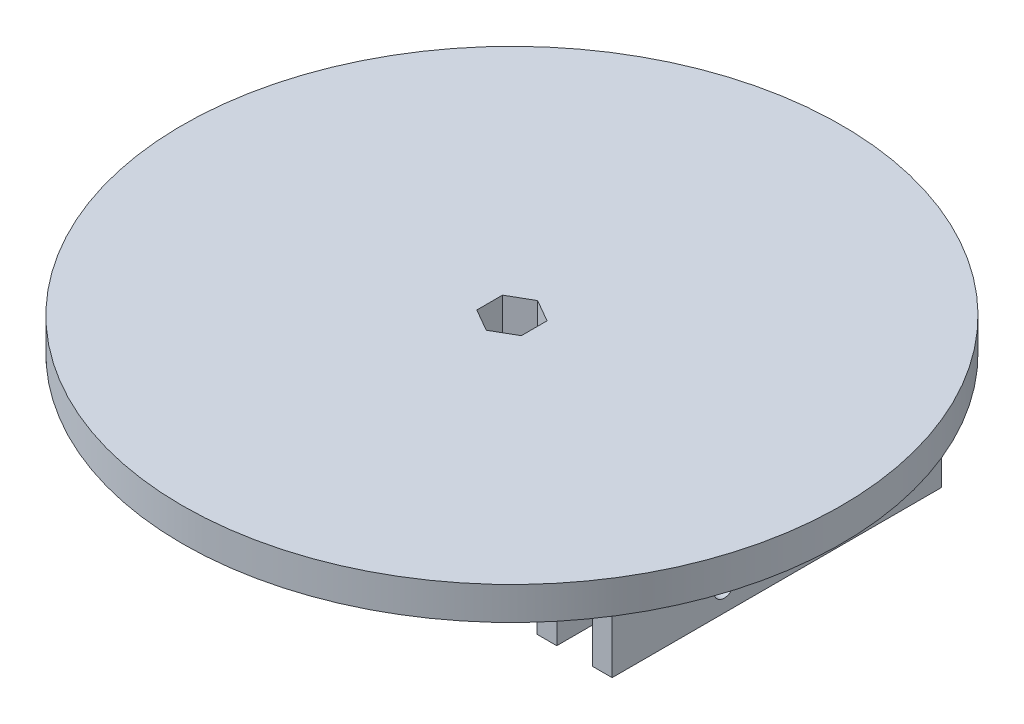
from build123d import *

# Parameters (mm, degrees)
SKETCH2_R               = 9
BOSS_EXTRUDE1_DEPTH     = 20
CUT_EXTRUDE1_DEPTH      = 20
SKETCH4_R               = 50
SKETCH4_R_2             = 4.5
BOSS_EXTRUDE3_DEPTH     = 5
CUT_EXTRUDE2_DEPTH      = 9
CUT_EXTRUDE2_DEPTH_BACK = 9
SKETCH11_R              = 1.55
CUT_EXTRUDE9_DEPTH      = 9
CUT_EXTRUDE9_DEPTH_BACK = 9
SKETCH15_R              = 1.55
SKETCH16_W              = 3
SKETCH16_H              = 50
BOSS_EXTRUDE4_DEPTH     = 10
CUT_EXTRUDE10_REACH     = 107.053
SKETCH17_R              = 1.55
CUT_EXTRUDE11_START     = -11.4
SKETCH18_R              = 1.55
CUT_EXTRUDE11_DEPTH     = 11.4
CUT_EXTRUDE14_START     = 9
SKETCH19_R              = 3.5
CUT_EXTRUDE14_DEPTH     = 3
CUT_EXTRUDE15_START     = -6
SKETCH19_3_R            = 3.5
CUT_EXTRUDE15_DEPTH     = 3
CUT_EXTRUDE16_START     = 9
SKETCH20_R              = 3.5
CUT_EXTRUDE16_DEPTH     = 3
CUT_EXTRUDE17_START     = -6
SKETCH20_2_R            = 3.5
CUT_EXTRUDE17_DEPTH     = 3


with BuildPart() as part:
    # Sketch2 → Boss-Extrude1 (new body)
    with BuildSketch(Plane(origin=(0, 0, 0), x_dir=(1, 0, 0), z_dir=(0, 1, 0))):
        with Locations(Location((0, 0, 0), (0, 0, 270))):
            Circle(SKETCH2_R)
    extrude(amount=BOSS_EXTRUDE1_DEPTH)

    # Sketch3 → Cut-Extrude1 (cut)
    with BuildSketch(Plane(origin=(0, 20, 0), x_dir=(1, 0, 0), z_dir=(0, 1, 0))):
        Polygon((0, 3.9), (-3.377499075, 1.95), (-3.377499075, -1.95), (0, -3.9), (3.377499075, -1.95), (3.377499075, 1.95), align=None)
    extrude(amount=-CUT_EXTRUDE1_DEPTH, mode=Mode.SUBTRACT)

    # Sketch4 → Boss-Extrude3 (add)
    with BuildSketch(Plane(origin=(0, 20, 0), x_dir=(1, 0, 0), z_dir=(0, 1, 0))):
        with Locations(Location((0, 0, 0), (0, 0, 270))):
            Circle(SKETCH4_R)
        Circle(SKETCH4_R_2, mode=Mode.SUBTRACT)
    extrude(amount=-BOSS_EXTRUDE3_DEPTH)

    # Sketch11 → Cut-Extrude2 (cut, two sides: drawn at the far end of the back side and taken through both)
    with BuildSketch(Plane(origin=(0, 0, 0), x_dir=(-0.8660254037844387, 0, -0.49999999999999983), z_dir=(0.49999999999999983, 0, -0.8660254037844387)).offset(-CUT_EXTRUDE2_DEPTH_BACK)):
        with Locations(Location((0, 5, 0), (0, 0, 180))):
            Circle(SKETCH11_R)
    extrude(amount=CUT_EXTRUDE2_DEPTH + CUT_EXTRUDE2_DEPTH_BACK, mode=Mode.SUBTRACT)

    # Sketch15 → Cut-Extrude9 (cut, two sides: drawn at the far end of the back side and taken through both)
    with BuildSketch(Plane(origin=(0, 0, 0), x_dir=(-0.866025403784439, 0, 0.49999999999999944), z_dir=(-0.49999999999999944, 0, -0.866025403784439)).offset(-CUT_EXTRUDE9_DEPTH_BACK)):
        with Locations(Location((0, 9, 0), (0, 0, 270))):
            Circle(SKETCH15_R)
    extrude(amount=CUT_EXTRUDE9_DEPTH + CUT_EXTRUDE9_DEPTH_BACK, mode=Mode.SUBTRACT)

    # Sketch16 → Boss-Extrude4 (add)
    with BuildSketch(Plane.XZ.offset(-15)):
        with Locations((-30.3, 0)):
            Rectangle(SKETCH16_W, SKETCH16_H)
        with Locations((-38.7, 0)):
            Rectangle(SKETCH16_W, SKETCH16_H)
        with Locations((30.3, 0)):
            Rectangle(SKETCH16_W, SKETCH16_H)
        with Locations((38.7, 0)):
            Rectangle(SKETCH16_W, SKETCH16_H)
    extrude(amount=BOSS_EXTRUDE4_DEPTH)

    # Cut-Extrude10: up to this face of the body (flat: up to its plane)
    cut_extrude10_end = Plane(part.part.faces().sort_by_distance((-28.8, 10, 0))[0])
    # Sketch17 → Cut-Extrude10 (cut, up to the picked face)
    with BuildSketch(Plane.ZY.offset(40.2), mode=Mode.PRIVATE) as cut_extrude10_sk1:
        with Locations((-16, 11.5)):
            Circle(SKETCH17_R)
    cut_extrude10_tool1 = split(extrude(cut_extrude10_sk1.sketch, amount=-CUT_EXTRUDE10_REACH, mode=Mode.PRIVATE), bisect_by=cut_extrude10_end, keep=Keep.BOTH, mode=Mode.PRIVATE)
    # Sketch17 → Cut-Extrude10 (cut, up to the picked face)
    with BuildSketch(Plane.ZY.offset(40.2), mode=Mode.PRIVATE) as cut_extrude10_sk2:
        with Locations((-8, 8.5)):
            Circle(SKETCH17_R)
    cut_extrude10_tool2 = split(extrude(cut_extrude10_sk2.sketch, amount=-CUT_EXTRUDE10_REACH, mode=Mode.PRIVATE), bisect_by=cut_extrude10_end, keep=Keep.BOTH, mode=Mode.PRIVATE)
    # Sketch17 → Cut-Extrude10 (cut, up to the picked face)
    with BuildSketch(Plane.ZY.offset(40.2), mode=Mode.PRIVATE) as cut_extrude10_sk3:
        with Locations((8, 8.5)):
            Circle(SKETCH17_R)
    cut_extrude10_tool3 = split(extrude(cut_extrude10_sk3.sketch, amount=-CUT_EXTRUDE10_REACH, mode=Mode.PRIVATE), bisect_by=cut_extrude10_end, keep=Keep.BOTH, mode=Mode.PRIVATE)
    # Sketch17 → Cut-Extrude10 (cut, up to the picked face)
    with BuildSketch(Plane.ZY.offset(40.2), mode=Mode.PRIVATE) as cut_extrude10_sk4:
        with Locations((16, 11.5)):
            Circle(SKETCH17_R)
    cut_extrude10_tool4 = split(extrude(cut_extrude10_sk4.sketch, amount=-CUT_EXTRUDE10_REACH, mode=Mode.PRIVATE), bisect_by=cut_extrude10_end, keep=Keep.BOTH, mode=Mode.PRIVATE)
    add(cut_extrude10_tool1.solids().sort_by(Axis((-40.2, 11.5, -16), (1, 0, 0)))[0], mode=Mode.SUBTRACT)
    add(cut_extrude10_tool2.solids().sort_by(Axis((-40.2, 8.5, -8), (1, 0, 0)))[0], mode=Mode.SUBTRACT)
    add(cut_extrude10_tool3.solids().sort_by(Axis((-40.2, 8.5, 8), (1, 0, 0)))[0], mode=Mode.SUBTRACT)
    add(cut_extrude10_tool4.solids().sort_by(Axis((-40.2, 11.5, 16), (1, 0, 0)))[0], mode=Mode.SUBTRACT)

    # Sketch18 → Cut-Extrude11 (cut)
    with BuildSketch(Plane(origin=(40.2, 0, 0), x_dir=(0, 0, -1), z_dir=(1, 0, 0)).offset(CUT_EXTRUDE11_START)):
        with Locations(Location((-8, 8.5, 0), (0, 0, 180))):
            Circle(SKETCH18_R)
        with Locations(Location((8, 8.5, 0), (0, 0, 180))):
            Circle(SKETCH18_R)
        with Locations(Location((16, 11.5, 0), (0, 0, 180))):
            Circle(SKETCH18_R)
        with Locations(Location((-16, 11.5, 0), (0, 0, 180))):
            Circle(SKETCH18_R)
    extrude(amount=CUT_EXTRUDE11_DEPTH, mode=Mode.SUBTRACT)

    # Sketch19 → Cut-Extrude14 (cut)
    with BuildSketch(Plane(origin=(0, 0, 0), x_dir=(-0.866025403784439, 0, 0.49999999999999944), z_dir=(-0.49999999999999944, 0, -0.866025403784439)).offset(CUT_EXTRUDE14_START)):
        with Locations((0, 9)):
            Circle(SKETCH19_R)
    extrude(amount=-CUT_EXTRUDE14_DEPTH, mode=Mode.SUBTRACT)

    # Sketch19<3> → Cut-Extrude15 (cut)
    with BuildSketch(Plane(origin=(0, 0, 0), x_dir=(-0.866025403784439, 0, 0.49999999999999944), z_dir=(-0.49999999999999944, 0, -0.866025403784439)).offset(CUT_EXTRUDE15_START)):
        with Locations((0, 9)):
            Circle(SKETCH19_3_R)
    extrude(amount=-CUT_EXTRUDE15_DEPTH, mode=Mode.SUBTRACT)

    # Sketch20 → Cut-Extrude16 (cut)
    with BuildSketch(Plane(origin=(0, 0, 0), x_dir=(-0.8660254037844387, 0, -0.49999999999999983), z_dir=(0.49999999999999983, 0, -0.8660254037844387)).offset(CUT_EXTRUDE16_START)):
        with Locations((0, 5)):
            Circle(SKETCH20_R)
    extrude(amount=-CUT_EXTRUDE16_DEPTH, mode=Mode.SUBTRACT)

    # Sketch20<2> → Cut-Extrude17 (cut)
    with BuildSketch(Plane(origin=(0, 0, 0), x_dir=(-0.8660254037844387, 0, -0.49999999999999983), z_dir=(0.49999999999999983, 0, -0.8660254037844387)).offset(CUT_EXTRUDE17_START)):
        with Locations((0, 5)):
            Circle(SKETCH20_2_R)
    extrude(amount=-CUT_EXTRUDE17_DEPTH, mode=Mode.SUBTRACT)


solid = part.part
